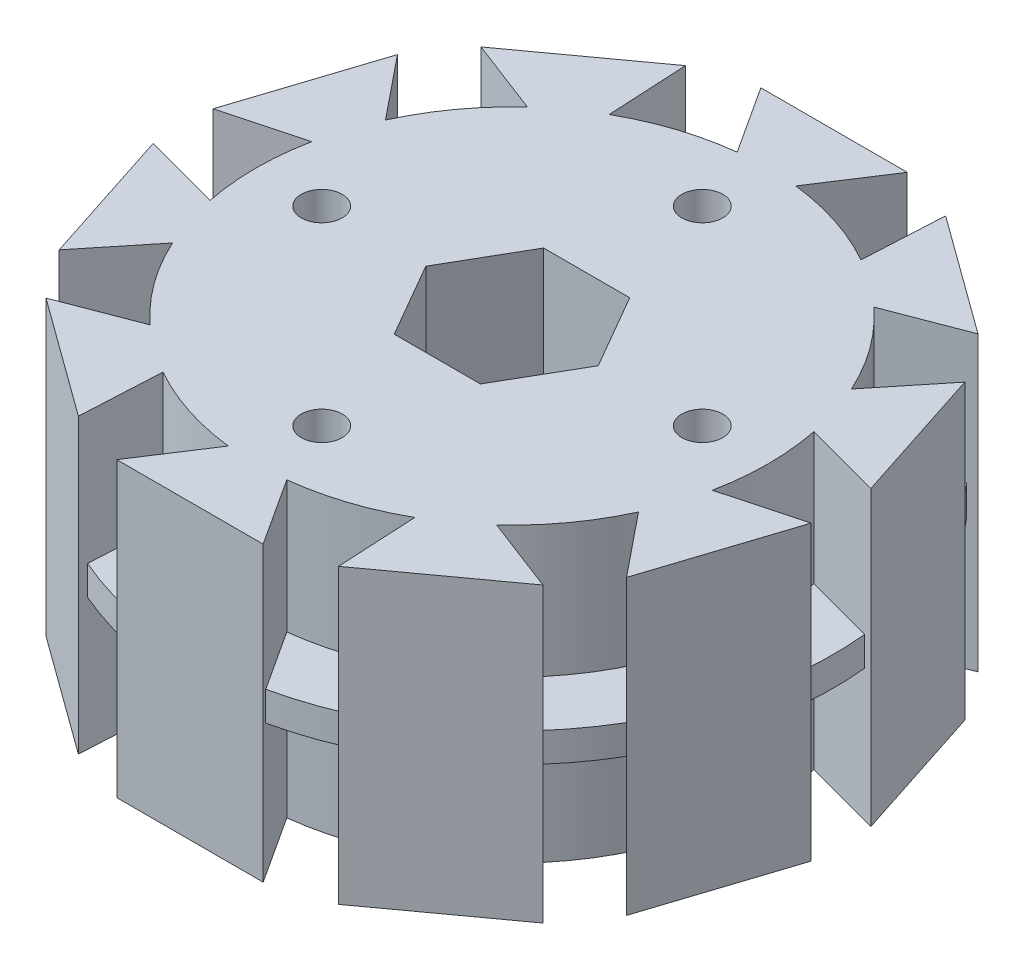
from build123d import *

# Parameters (mm, degrees)
SKETCH1_R           = 22.225
BOSS_EXTRUDE1_DEPTH = 25.4
CUT_EXTRUDE1_DEPTH  = 41.411152545
BOSS_EXTRUDE2_DEPTH = 25.4
CIRPATTERN1_COUNT   = 10
SKETCH5_R           = 27.94
SKETCH5_R_2         = 22.225
BOSS_EXTRUDE3_DEPTH = 1.27
SKETCH6_R           = 1.778
CUT_EXTRUDE2_DEPTH  = 48.329030175


with BuildPart() as part:
    # Sketch1 → Boss-Extrude1 (new body)
    with BuildSketch(Plane(origin=(0, 0, 0), x_dir=(1, 0, 0), z_dir=(0, 1, 0))):
        with Locations(Location((0, 0, 0), (0, 0, 270))):
            Circle(SKETCH1_R)
    extrude(amount=BOSS_EXTRUDE1_DEPTH)

    # Sketch2 → Cut-Extrude1 (cut, through all)
    with BuildSketch(Plane.XZ):
        Polygon((7.478995387, 0), (3.739497694, 6.477), (-3.739497694, 6.477), (-7.478995387, 0), (-3.739497694, -6.477), (3.739497694, -6.477), align=None)
    extrude(amount=-CUT_EXTRUDE1_DEPTH, mode=Mode.SUBTRACT)

    # Sketch3 → Boss-Extrude2 (add)
    with BuildSketch(Plane.XZ):
        with BuildLine():
            Line((-2.54, 22.079380086), (-6.35, 27.94))
            Line((-6.35, 27.94), (6.35, 27.94))
            Line((6.35, 27.94), (2.54, 22.079380086))
            ThreePointArc((2.54, 22.079380086), (0, 22.225), (-2.54, 22.079380086))
        make_face()
    boss_extrude2 = extrude(amount=-BOSS_EXTRUDE2_DEPTH)

    # CirPattern1: Boss-Extrude2 ×10 about axis
    cirpattern1_axis = Axis((0, 0, 0), (0, 1, 0))
    for i in range(1, CIRPATTERN1_COUNT):
        add(boss_extrude2.rotate(cirpattern1_axis, i * 360 / CIRPATTERN1_COUNT))

    # Sketch5 → Boss-Extrude3 (add, symmetric)
    with BuildSketch(Plane(origin=(0, 12.7, 0), x_dir=(1, 0, 0), z_dir=(0, 1, 0))):
        Circle(SKETCH5_R)
        Circle(SKETCH5_R_2, mode=Mode.SUBTRACT)
    extrude(amount=BOSS_EXTRUDE3_DEPTH, both=True)

    # Sketch6 → Cut-Extrude2 (cut, through all)
    with BuildSketch(Plane(origin=(0, 25.4, 0), x_dir=(1, 0, 0), z_dir=(0, 1, 0))):
        with Locations(Location((-16.51, 0, 0), (0, 0, 270))):
            Circle(SKETCH6_R)
        with Locations(Location((0, 16.51, 0), (0, 0, 270))):
            Circle(SKETCH6_R)
        with Locations(Location((16.51, 0, 0), (0, 0, 270))):
            Circle(SKETCH6_R)
        with Locations(Location((0, -16.51, 0), (0, 0, 270))):
            Circle(SKETCH6_R)
    extrude(amount=-CUT_EXTRUDE2_DEPTH, mode=Mode.SUBTRACT)


solid = part.part
